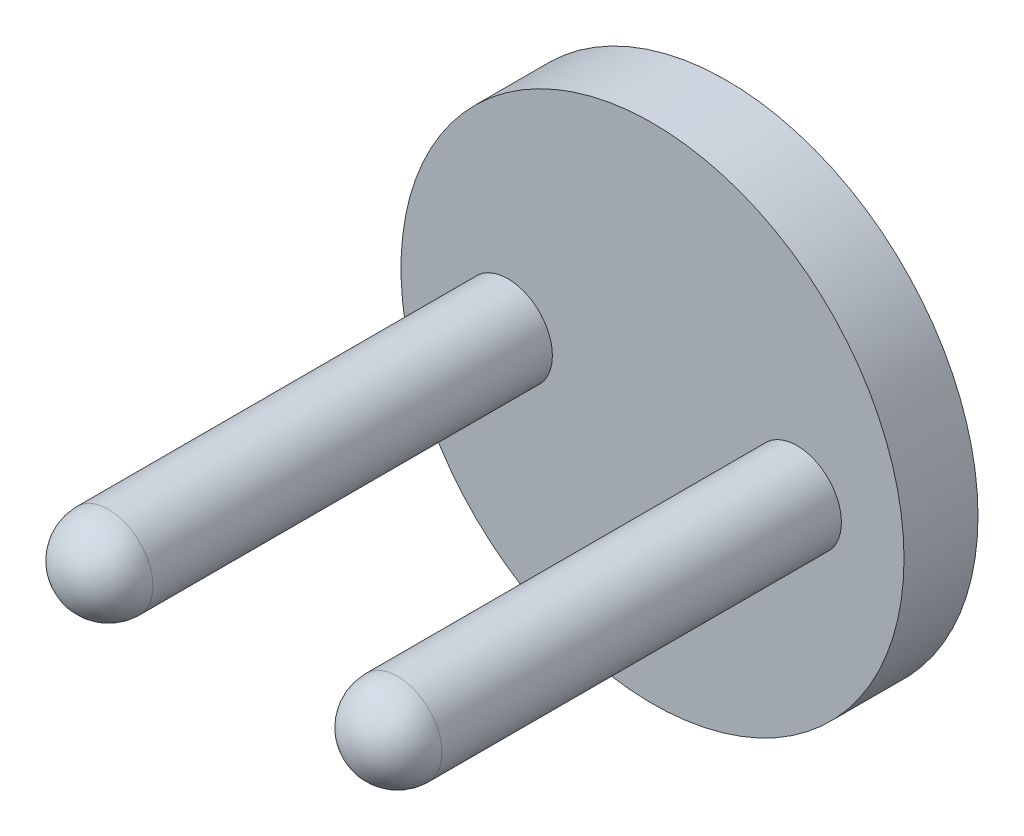
from build123d import *

# Parameters (mm, degrees)
SKETCH1_R           = 17
BOSS_EXTRUDE1_DEPTH = 5
SKETCH2_R           = 3
BOSS_EXTRUDE2_DEPTH = 30
SKETCH3_R           = 3.125
BOSS_EXTRUDE3_DEPTH = 4
FILLET1_R           = 3


with BuildPart() as part:
    # Sketch1 → Boss-Extrude1 (new body)
    with BuildSketch(Plane.XY):
        Circle(SKETCH1_R)
    extrude(amount=BOSS_EXTRUDE1_DEPTH)

    # Sketch2 → Boss-Extrude2 (add)
    with BuildSketch(Plane.XY.offset(5)):
        with Locations((-9.768207719, 0)):
            Circle(SKETCH2_R)
        with Locations((9.768207719, 0)):
            Circle(SKETCH2_R)
    extrude(amount=BOSS_EXTRUDE2_DEPTH)

    # Sketch3 → Boss-Extrude3 (add)
    with BuildSketch(Plane(origin=(0, 0, 0), x_dir=(-1, 0, 0), z_dir=(0, 0, -1))):
        Circle(SKETCH3_R)
    extrude(amount=BOSS_EXTRUDE3_DEPTH)

    # Fillet1
    fillet1_edges = [part.edges().sort_by_distance(p)[0] for p in [
        (-12.768207719, 0, 35),
        (6.768207719, 0, 35),
    ]]
    fillet(fillet1_edges, radius=FILLET1_R)


solid = part.part
